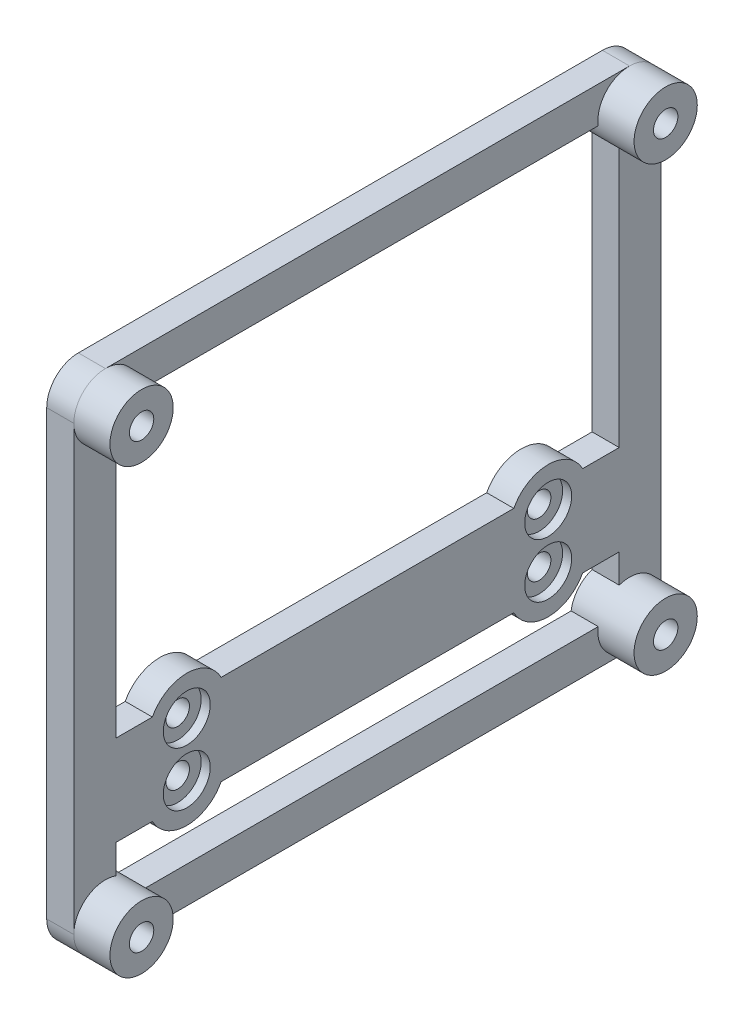
from build123d import *
from build123d.topology import SkipClean

# Parameters (mm, degrees)
SKETCH1_W           = 65
SKETCH1_H           = 56
SKETCH1_W_2         = 55.714285714
SKETCH1_H_2         = 48
BOSS_EXTRUDE1_DEPTH = 3
BOSS_EXTRUDE2_DEPTH = 4
BOSS_EXTRUDE3_DEPTH = 3
SKETCH4_R           = 1.35
CUT_EXTRUDE1_DEPTH  = 44.084219849
FILLET1_R           = 3.5
SKETCH5_W           = 55.714285714
SKETCH5_H           = 10
BOSS_EXTRUDE4_DEPTH = 3
SKETCH6_R           = 1.3
CUT_EXTRUDE2_DEPTH  = 44.084219849
BOSS_EXTRUDE5_DEPTH = 3
SKETCH8_R           = 2.6
CUT_EXTRUDE3_DEPTH  = 1


with BuildPart() as part:
    # Sketch1 → Boss-Extrude1 (new body)
    with BuildSketch(Plane(origin=(0, 0, 0), x_dir=(0, 0, -1), z_dir=(1, 0, 0))):
        Rectangle(SKETCH1_W, SKETCH1_H)
        Rectangle(SKETCH1_W_2, SKETCH1_H_2, mode=Mode.SUBTRACT)
    extrude(amount=BOSS_EXTRUDE1_DEPTH)

    # Sketch2 → Boss-Extrude2 (add)
    with BuildSketch(Plane(origin=(3, 0, 0), x_dir=(0, 0, -1), z_dir=(1, 0, 0))):
        with BuildLine():
            ThreePointArc((-25.5, 24.5), (-31.474873734, 26.974873734), (-29, 21))
            Line((-29, 21), (-29, 23.15))
            ThreePointArc((-29, 23.15), (-29.954594155, 25.454594155), (-27.65, 24.5))
            Line((-27.65, 24.5), (-25.5, 24.5))
        make_face()
        with BuildLine():
            Line((-29, 23.15), (-29, 21))
            ThreePointArc((-29, 21), (-28.420576225, 21.048294901), (-27.857142857, 21.191846807))
            Line((-27.857142857, 21.191846807), (-27.857142857, 23.781405851))
            ThreePointArc((-27.857142857, 23.781405851), (-28.347160855, 23.318348169), (-29, 23.15))
        make_face()
        with BuildLine():
            Line((-27.857142857, 23.781405851), (-27.857142857, 21.191846807))
            ThreePointArc((-27.857142857, 21.191846807), (-26.302325383, 22.270078104), (-25.535898385, 24))
            Line((-25.535898385, 24), (-27.74600638, 24))
            ThreePointArc((-27.74600638, 24), (-27.796600962, 23.888174245), (-27.857142857, 23.781405851))
        make_face()
        with BuildLine():
            ThreePointArc((-25.535898385, 24), (-25.508986132, 24.249356481), (-25.5, 24.5))
            Line((-25.5, 24.5), (-27.65, 24.5))
            ThreePointArc((-27.65, 24.5), (-27.674218836, 24.245433101), (-27.74600638, 24))
            Line((-27.74600638, 24), (-25.535898385, 24))
        make_face()
        with BuildLine():
            Line((29, 23.15), (29, 21))
            ThreePointArc((29, 21), (31.474873734, 22.025126266), (32.5, 24.5))
            ThreePointArc((32.5, 24.5), (29, 28), (25.5, 24.5))
            Line((25.5, 24.5), (27.65, 24.5))
            ThreePointArc((27.65, 24.5), (29, 25.85), (30.35, 24.5))
            ThreePointArc((30.35, 24.5), (29.954594155, 23.545405845), (29, 23.15))
        make_face()
        with BuildLine():
            Line((27.65, 24.5), (25.5, 24.5))
            ThreePointArc((25.5, 24.5), (25.508986132, 24.249356481), (25.535898385, 24))
            Line((25.535898385, 24), (27.74600638, 24))
            ThreePointArc((27.74600638, 24), (27.674218836, 24.245433101), (27.65, 24.5))
        make_face()
        with BuildLine():
            ThreePointArc((25.535898385, 24), (26.302325383, 22.270078104), (27.857142857, 21.191846807))
            Line((27.857142857, 21.191846807), (27.857142857, 23.781405851))
            ThreePointArc((27.857142857, 23.781405851), (27.796600962, 23.888174245), (27.74600638, 24))
            Line((27.74600638, 24), (25.535898385, 24))
        make_face()
        with BuildLine():
            Line((27.857142857, 23.781405851), (27.857142857, 21.191846807))
            ThreePointArc((27.857142857, 21.191846807), (28.420576225, 21.048294901), (29, 21))
            Line((29, 21), (29, 23.15))
            ThreePointArc((29, 23.15), (28.347160855, 23.318348169), (27.857142857, 23.781405851))
        make_face()
        with BuildLine():
            Line((27.65, -24.5), (25.5, -24.5))
            ThreePointArc((25.5, -24.5), (29, -28), (32.5, -24.5))
            ThreePointArc((32.5, -24.5), (31.474873734, -22.025126266), (29, -21))
            Line((29, -21), (29, -23.15))
            ThreePointArc((29, -23.15), (29.954594155, -23.545405845), (30.35, -24.5))
            ThreePointArc((30.35, -24.5), (29, -25.85), (27.65, -24.5))
        make_face()
        with BuildLine():
            ThreePointArc((29, -21), (28.420576225, -21.048294901), (27.857142857, -21.191846807))
            Line((27.857142857, -21.191846807), (27.857142857, -23.781405851))
            ThreePointArc((27.857142857, -23.781405851), (28.347160855, -23.318348169), (29, -23.15))
            Line((29, -23.15), (29, -21))
        make_face()
        with BuildLine():
            ThreePointArc((27.857142857, -21.191846807), (26.302325383, -22.270078104), (25.535898385, -24))
            Line((25.535898385, -24), (27.74600638, -24))
            ThreePointArc((27.74600638, -24), (27.796600962, -23.888174245), (27.857142857, -23.781405851))
            Line((27.857142857, -23.781405851), (27.857142857, -21.191846807))
        make_face()
        with BuildLine():
            ThreePointArc((25.535898385, -24), (25.508986132, -24.249356481), (25.5, -24.5))
            Line((25.5, -24.5), (27.65, -24.5))
            ThreePointArc((27.65, -24.5), (27.674218836, -24.245433101), (27.74600638, -24))
            Line((27.74600638, -24), (25.535898385, -24))
        make_face()
        with BuildLine():
            ThreePointArc((-29, -21), (-31.474873734, -26.974873734), (-25.5, -24.5))
            Line((-25.5, -24.5), (-27.65, -24.5))
            ThreePointArc((-27.65, -24.5), (-29.954594155, -25.454594155), (-29, -23.15))
            Line((-29, -23.15), (-29, -21))
        make_face()
        with BuildLine():
            ThreePointArc((-27.857142857, -21.191846807), (-28.420576225, -21.048294901), (-29, -21))
            Line((-29, -21), (-29, -23.15))
            ThreePointArc((-29, -23.15), (-28.347160855, -23.318348169), (-27.857142857, -23.781405851))
            Line((-27.857142857, -23.781405851), (-27.857142857, -21.191846807))
        make_face()
        with BuildLine():
            Line((-27.74600638, -24), (-25.535898385, -24))
            ThreePointArc((-25.535898385, -24), (-26.302325383, -22.270078104), (-27.857142857, -21.191846807))
            Line((-27.857142857, -21.191846807), (-27.857142857, -23.781405851))
            ThreePointArc((-27.857142857, -23.781405851), (-27.796600962, -23.888174245), (-27.74600638, -24))
        make_face()
        with BuildLine():
            Line((-27.65, -24.5), (-25.5, -24.5))
            ThreePointArc((-25.5, -24.5), (-25.508986132, -24.249356481), (-25.535898385, -24))
            Line((-25.535898385, -24), (-27.74600638, -24))
            ThreePointArc((-27.74600638, -24), (-27.674218836, -24.245433101), (-27.65, -24.5))
        make_face()
    extrude(amount=BOSS_EXTRUDE2_DEPTH)

    # Sketch3 → Boss-Extrude3 (add)
    with SkipClean():  # the faces are left unmerged after this step: merging them gives an invalid solid
        with BuildSketch(Plane.ZY):
            with BuildLine():
                Line((-27.74600638, 24), (-27.857142857, 24))
                Line((-27.857142857, 24), (-27.857142857, 23.781405851))
                Line((-27.857142857, 23.781405851), (-27.857142857, 21.191846807))
                ThreePointArc((-27.857142857, 21.191846807), (-26.302325383, 22.270078104), (-25.535898385, 24))
                Line((-25.535898385, 24), (-27.74600638, 24))
            make_face()
            with BuildLine():
                Line((27.857142857, 21.191846807), (27.857142857, 23.781405851))
                Line((27.857142857, 23.781405851), (27.857142857, 24))
                Line((27.857142857, 24), (27.74600638, 24))
                Line((27.74600638, 24), (25.535898385, 24))
                ThreePointArc((25.535898385, 24), (26.302325383, 22.270078104), (27.857142857, 21.191846807))
            make_face()
            with BuildLine():
                Line((-27.857142857, -21.191846807), (-27.857142857, -23.781405851))
                Line((-27.857142857, -23.781405851), (-27.857142857, -24))
                Line((-27.857142857, -24), (-27.74600638, -24))
                Line((-27.74600638, -24), (-25.535898385, -24))
                ThreePointArc((-25.535898385, -24), (-26.302325383, -22.270078104), (-27.857142857, -21.191846807))
            make_face()
            with BuildLine():
                Line((27.857142857, -23.781405851), (27.857142857, -21.191846807))
                ThreePointArc((27.857142857, -21.191846807), (26.302325383, -22.270078104), (25.535898385, -24))
                Line((25.535898385, -24), (27.74600638, -24))
                Line((27.74600638, -24), (27.857142857, -24))
                Line((27.857142857, -24), (27.857142857, -23.781405851))
            make_face()
        extrude(amount=-BOSS_EXTRUDE3_DEPTH)

    # Sketch4 → Cut-Extrude1 (cut, through all)
    with BuildSketch(Plane(origin=(3, 0, 0), x_dir=(0, 0, -1), z_dir=(1, 0, 0))):
        with Locations((29, -24.5)):
            Circle(SKETCH4_R)
        with Locations((-29, -24.5)):
            Circle(SKETCH4_R)
        with Locations((29, 24.5)):
            Circle(SKETCH4_R)
        with Locations((-29, 24.5)):
            Circle(SKETCH4_R)
    extrude(amount=-CUT_EXTRUDE1_DEPTH, mode=Mode.SUBTRACT)

    # Fillet1
    fillet1_edges = [part.edges().sort_by_distance(p)[0] for p in [
        (1.5, -28, 32.5),
        (1.5, 28, 32.5),
        (1.5, -28, -32.5),
        (1.5, 28, -32.5),
    ]]
    fillet(fillet1_edges, radius=FILLET1_R)

    # Sketch5 → Boss-Extrude4 (add)
    with BuildSketch(Plane(origin=(3, 0, 0), x_dir=(0, 0, -1), z_dir=(1, 0, 0))):
        with Locations((0, -13)):
            Rectangle(SKETCH5_W, SKETCH5_H)
    extrude(amount=-BOSS_EXTRUDE4_DEPTH)

    # Sketch6 → Cut-Extrude2 (cut, through all)
    with SkipClean():  # the faces are left unmerged after this step: merging them gives an invalid solid
        with BuildSketch(Plane(origin=(3, 0, 0), x_dir=(0, 0, -1), z_dir=(1, 0, 0))):
            with Locations((-20, -10)):
                Circle(SKETCH6_R)
            with Locations((-20, -16)):
                Circle(SKETCH6_R)
            with Locations((20, -10)):
                Circle(SKETCH6_R)
            with Locations((20, -16)):
                Circle(SKETCH6_R)
        extrude(amount=-CUT_EXTRUDE2_DEPTH, mode=Mode.SUBTRACT)

    # Sketch7 → Boss-Extrude5 (add)
    with SkipClean():  # the faces are left unmerged after this step: merging them gives an invalid solid
        with BuildSketch(Plane(origin=(3, 0, 0), x_dir=(0, 0, -1), z_dir=(1, 0, 0))):
            with BuildLine():
                Line((-23.806573262, -8), (-16.193426738, -8))
                ThreePointArc((-16.193426738, -8), (-20, -5.7), (-23.806573262, -8))
            make_face()
            with BuildLine():
                Line((16.193426738, -8), (23.806573262, -8))
                ThreePointArc((23.806573262, -8), (20, -5.7), (16.193426738, -8))
            make_face()
            with BuildLine():
                ThreePointArc((-23.806573262, -18), (-20, -20.3), (-16.193426738, -18))
                Line((-16.193426738, -18), (-23.806573262, -18))
            make_face()
            with BuildLine():
                Line((23.806573262, -18), (16.193426738, -18))
                ThreePointArc((16.193426738, -18), (20, -20.3), (23.806573262, -18))
            make_face()
        extrude(amount=-BOSS_EXTRUDE5_DEPTH)

    # Sketch8 → Cut-Extrude3 (cut)
    with SkipClean():  # the faces are left unmerged after this step: merging them gives an invalid solid
        with BuildSketch(Plane(origin=(3, 0, 0), x_dir=(0, 0, -1), z_dir=(1, 0, 0))):
            with Locations((-20, -10)):
                Circle(SKETCH8_R)
            with Locations((-20, -16)):
                Circle(SKETCH8_R)
            with Locations((20, -10)):
                Circle(SKETCH8_R)
            with Locations((20, -16)):
                Circle(SKETCH8_R)
        extrude(amount=-CUT_EXTRUDE3_DEPTH, mode=Mode.SUBTRACT)


solid = part.part
